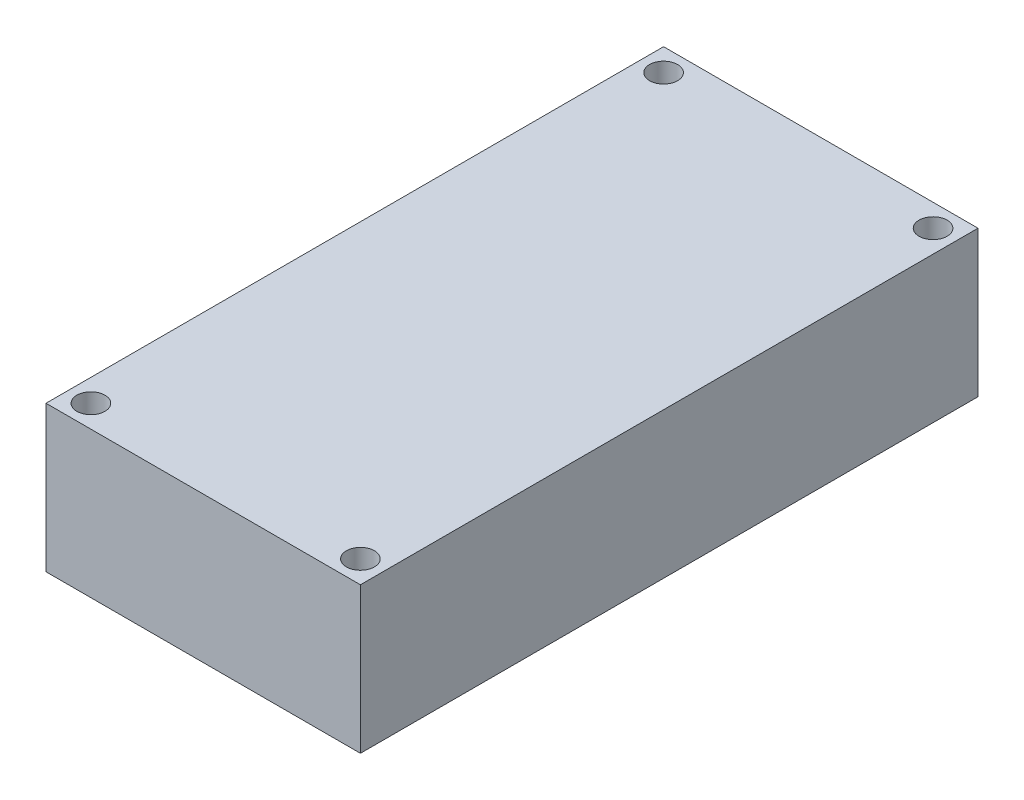
from build123d import *

# Parameters (mm, degrees)
SKETCH_1_W         = 28
SKETCH_1_H         = 13
EXTRUDE_1_DEPTH    = 27.5
SKETCH1_R          = 1.25
CUT_EXTRUDE1_DEPTH = 34.485071301


with BuildPart() as part:
    # 草图1 → 凸台-拉伸1 (new, symmetric)
    with BuildSketch(Plane.XY):
        Rectangle(SKETCH_1_W, SKETCH_1_H)
    extrude(amount=EXTRUDE_1_DEPTH, both=True)

    # Sketch1 → Cut-Extrude1 (cut, through all)
    with BuildSketch(Plane(origin=(0, 6.5, 0), x_dir=(1, 0, 0), z_dir=(0, 1, 0))):
        with Locations(Location((-12, 25.5, 0), (0, 0, 180))):
            Circle(SKETCH1_R)
        with Locations((12, 25.5)):
            Circle(SKETCH1_R)
        with Locations(Location((12, -25.5, 0), (0, 0, 180))):
            Circle(SKETCH1_R)
        with Locations((-12, -25.5)):
            Circle(SKETCH1_R)
    extrude(amount=-CUT_EXTRUDE1_DEPTH, mode=Mode.SUBTRACT)


solid = part.part
